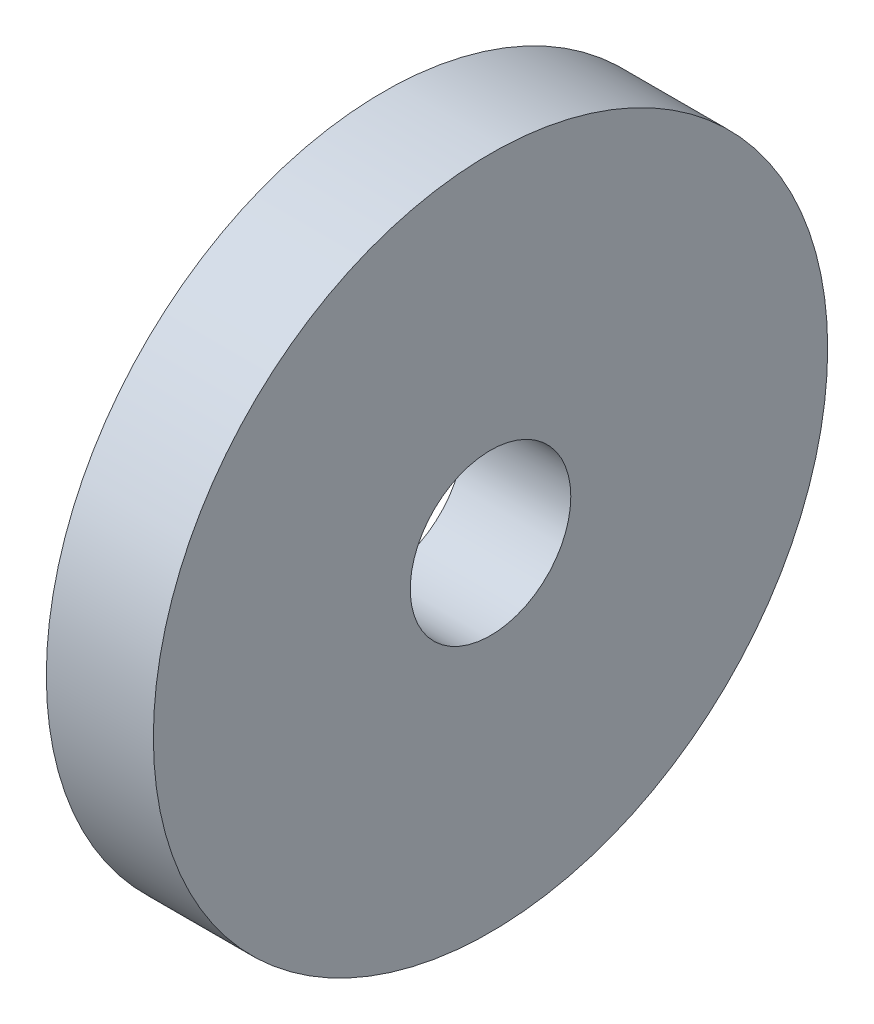
from build123d import *

# Parameters (mm, degrees)
SKETCH1_R           = 6.3
SKETCH1_R_2         = 1.5
BOSS_EXTRUDE1_DEPTH = 2


with BuildPart() as part:
    # Sketch1 → Boss-Extrude1 (new body)
    with BuildSketch(Plane(origin=(0, 0, 0), x_dir=(0, 0, -1), z_dir=(1, 0, 0))):
        Circle(SKETCH1_R)
        Circle(SKETCH1_R_2, mode=Mode.SUBTRACT)
    extrude(amount=BOSS_EXTRUDE1_DEPTH)


solid = part.part
